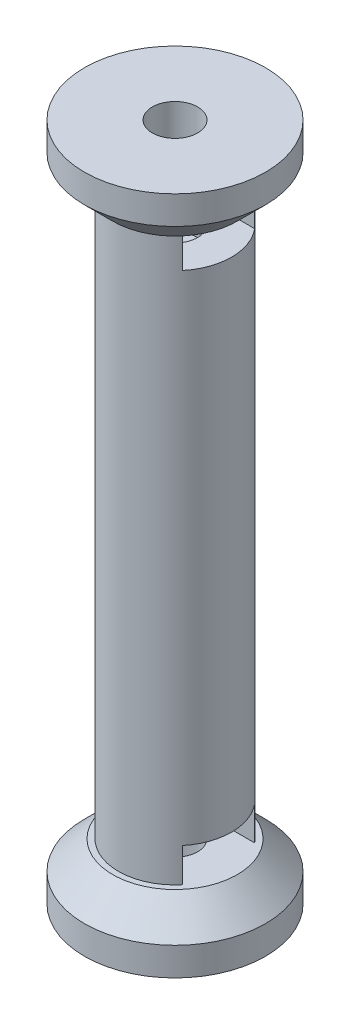
from build123d import *

# Parameters (mm, degrees)
SKETCH1_R                = 5
BOSS_EXTRUDE1_DEPTH      = 25
SKETCH2_R                = 8
BOSS_EXTRUDE2_DEPTH      = 5
CHAMFER2_SIZE            = 2.5
SKETCH3_R                = 2
CUT_EXTRUDE1_DEPTH       = 10
SKETCH6_W                = 14.643635598
SKETCH6_H                = 6.4
CUT_EXTRUDE2_DEPTH       = 3
CHAMFER4_SIZE            = 1
CHAMFER2_OF_MIRROR4_SIZE = 2.5
CHAMFER4_OF_MIRROR4_SIZE = 1


with BuildPart() as part:
    # Sketch1 → Boss-Extrude1 (new, symmetric)
    with BuildSketch(Plane(origin=(0, 0, 0), x_dir=(1, 0, 0), z_dir=(0, 1, 0))):
        with Locations(Location((0, 0, 0), (0, 0, 270))):
            Circle(SKETCH1_R)
    extrude(amount=BOSS_EXTRUDE1_DEPTH, both=True)

    # Sketch2 → Boss-Extrude2 (add)
    with BuildSketch(Plane(origin=(0, 25, 0), x_dir=(1, 0, 0), z_dir=(0, 1, 0))):
        with Locations(Location((0, 0, 0), (0, 0, 270))):
            Circle(SKETCH2_R)
    boss_extrude2 = extrude(amount=BOSS_EXTRUDE2_DEPTH)

    # Chamfer2
    chamfer2_edges = [part.edges().sort_by_distance(p)[0] for p in [
        (0, 25, -8),
    ]]
    chamfer(chamfer2_edges, length=CHAMFER2_SIZE)

    # Sketch3 → Cut-Extrude1 (cut)
    with BuildSketch(Plane(origin=(0, 30, 0), x_dir=(1, 0, 0), z_dir=(0, 1, 0))):
        with Locations(Location((0, 0, 0), (0, 0, 270))):
            Circle(SKETCH3_R)
    cut_extrude1 = extrude(amount=-CUT_EXTRUDE1_DEPTH, mode=Mode.SUBTRACT)

    # Sketch6 → Cut-Extrude2 (cut)
    with BuildSketch(Plane(origin=(0, 25, 0), x_dir=(-1, 0, 0), z_dir=(0, -1, 0))):
        with Locations((-3.821817799, 0)):
            Rectangle(SKETCH6_W, SKETCH6_H)
    cut_extrude2 = extrude(amount=CUT_EXTRUDE2_DEPTH, mode=Mode.SUBTRACT)

    # Chamfer4
    chamfer4_edges = [part.edges().sort_by_distance(p)[0] for p in [
        (-3.5, 23.5, -3.2),
        (-3.5, 23.5, 3.2),
    ]]
    chamfer(chamfer4_edges, length=CHAMFER4_SIZE)

    # Mirror4: Boss-Extrude2, Cut-Extrude1, Cut-Extrude2 across plane
    add(boss_extrude2.mirror(Plane(origin=(0, 0, 0), x_dir=(0, 0, 1), z_dir=(0, -1, 0))))
    add(cut_extrude1.mirror(Plane(origin=(0, 0, 0), x_dir=(0, 0, 1), z_dir=(0, -1, 0))), mode=Mode.SUBTRACT)
    add(cut_extrude2.mirror(Plane(origin=(0, 0, 0), x_dir=(0, 0, 1), z_dir=(0, -1, 0))), mode=Mode.SUBTRACT)

    # Chamfer2 of Mirror4
    chamfer2_of_mirror4_edges = [part.edges().sort_by_distance(p)[0] for p in [
        (0, -25, -8),
    ]]
    chamfer(chamfer2_of_mirror4_edges, length=CHAMFER2_OF_MIRROR4_SIZE)

    # Chamfer4 of Mirror4
    chamfer4_of_mirror4_edges = [part.edges().sort_by_distance(p)[0] for p in [
        (-3.5, -23.5, -3.2),
        (-3.5, -23.5, 3.2),
    ]]
    chamfer(chamfer4_of_mirror4_edges, length=CHAMFER4_OF_MIRROR4_SIZE)


solid = part.part
